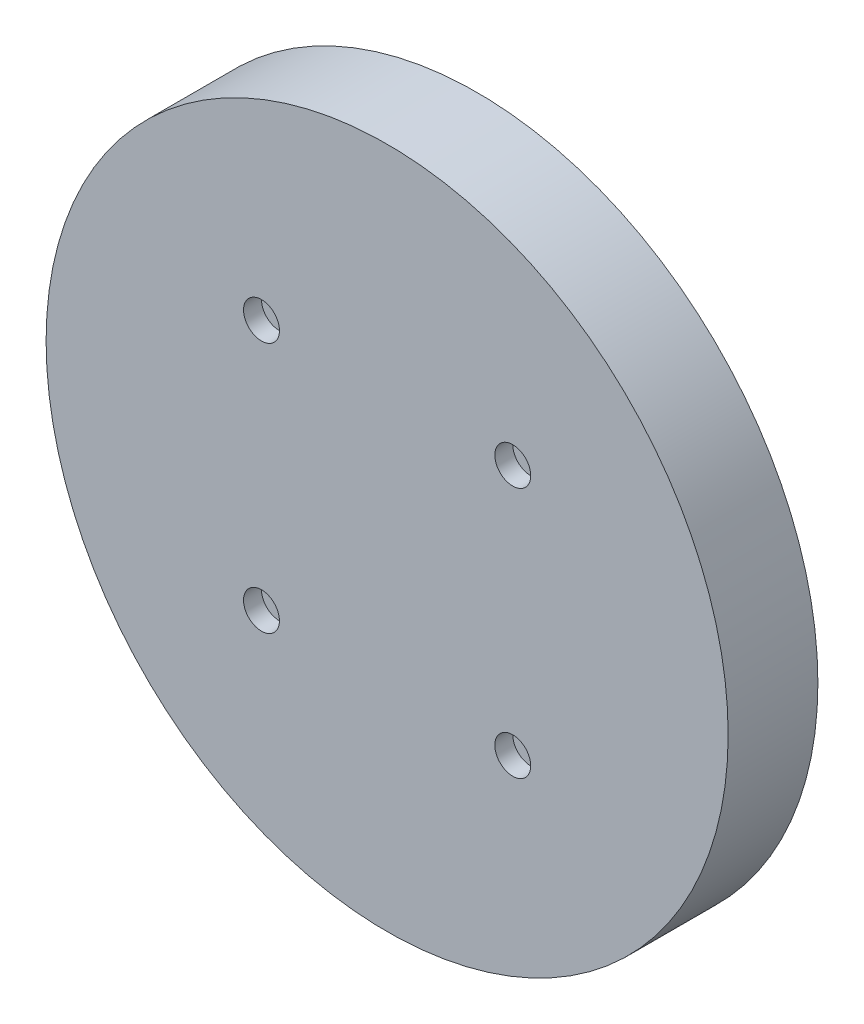
from build123d import *

# Parameters (mm, degrees)
SKETCH1_R           = 19
BOSS_EXTRUDE1_DEPTH = 5
SKETCH2_R           = 1
CUT_EXTRUDE1_DEPTH  = 1


with BuildPart() as part:
    # Sketch1 → Boss-Extrude1 (new body)
    with BuildSketch(Plane.XY):
        Circle(SKETCH1_R)
    extrude(amount=BOSS_EXTRUDE1_DEPTH)

    # Sketch2 → Cut-Extrude1 (cut)
    with BuildSketch(Plane.XY.offset(5)):
        with Locations((-7, 7)):
            Circle(SKETCH2_R)
        with Locations(Location((7, 7, 0), (0, 0, 180))):
            Circle(SKETCH2_R)
        with Locations((7, -7)):
            Circle(SKETCH2_R)
        with Locations(Location((-7, -7, 0), (0, 0, 180))):
            Circle(SKETCH2_R)
    extrude(amount=-CUT_EXTRUDE1_DEPTH, mode=Mode.SUBTRACT)


solid = part.part
